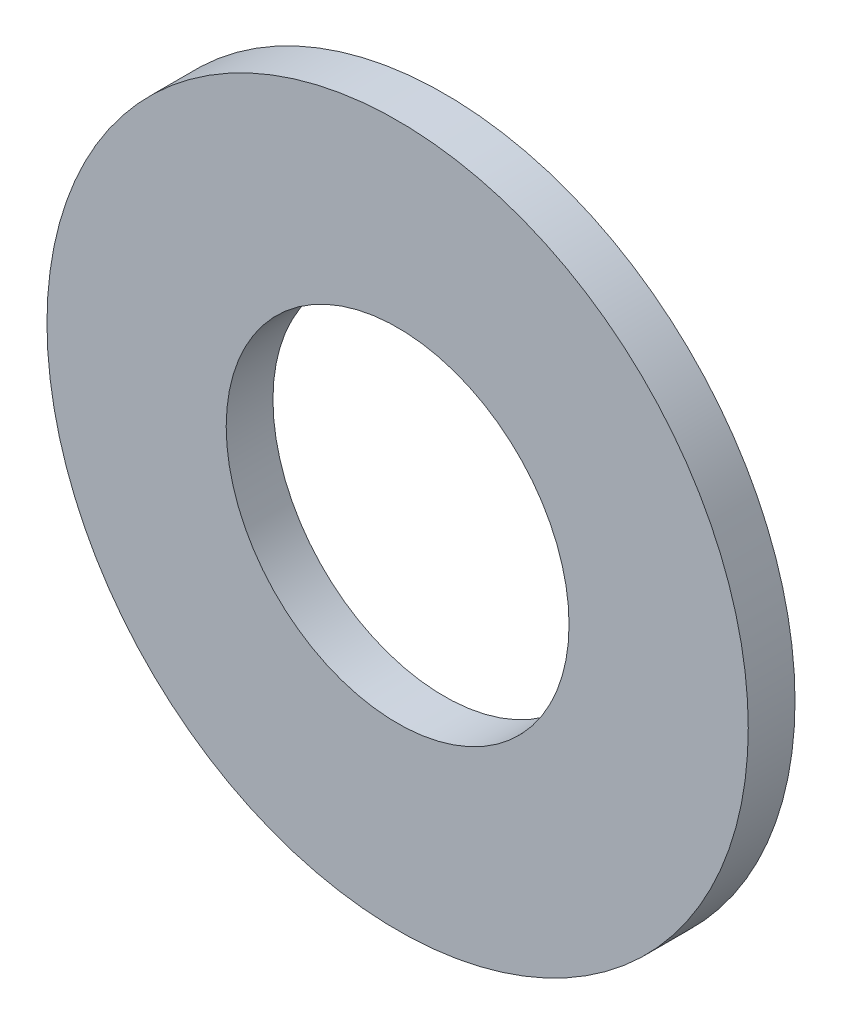
from build123d import *

# Parameters (mm, degrees)
SKETCH3_R           = 2.25
SKETCH3_R_2         = 1.1
BOSS_EXTRUDE1_DEPTH = 0.15


with BuildPart() as part:
    # Sketch3 → Boss-Extrude1 (new, symmetric)
    with BuildSketch(Plane.XY):
        Circle(SKETCH3_R)
        Circle(SKETCH3_R_2, mode=Mode.SUBTRACT)
    extrude(amount=BOSS_EXTRUDE1_DEPTH, both=True)


solid = part.part
